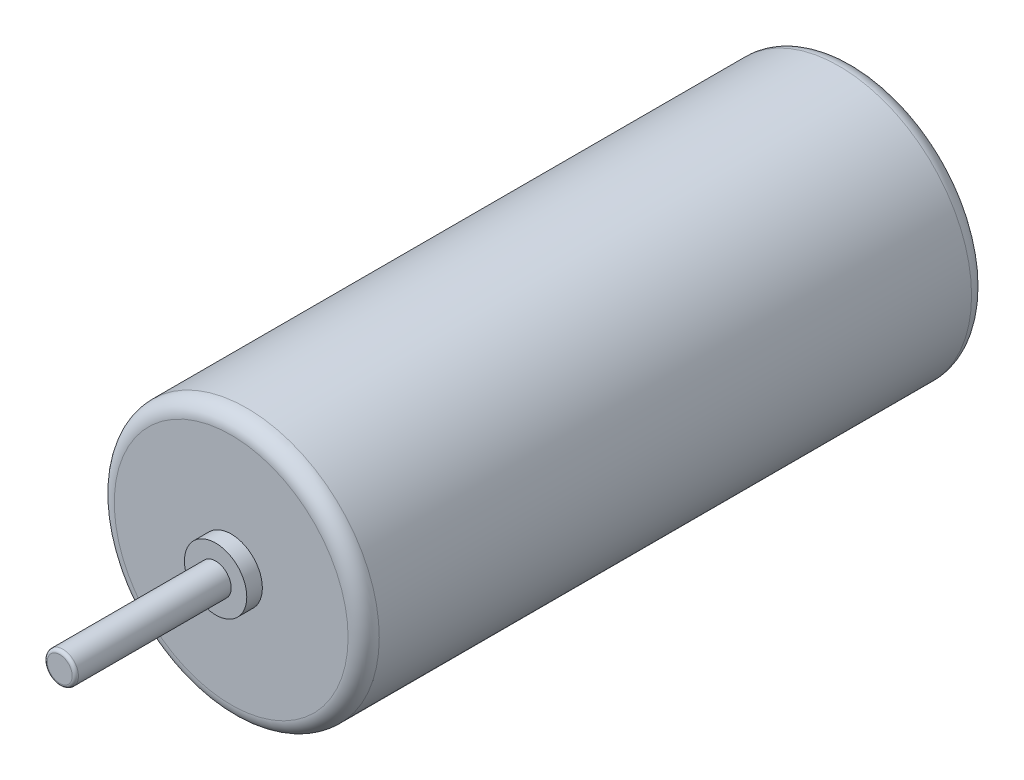
from build123d import *

# Parameters (mm, degrees)
SKETCH1_R           = 4.25
BOSS_EXTRUDE1_DEPTH = 20
SKETCH2_R           = 1
BOSS_EXTRUDE2_DEPTH = 0.5
SKETCH3_R           = 0.5
BOSS_EXTRUDE3_DEPTH = 5
FILLET2_R           = 0.5
FILLET3_R           = 0.1
FILLET4_R           = 0.5


with BuildPart() as part:
    # Sketch1 → Boss-Extrude1 (new body)
    with BuildSketch(Plane.XY):
        Circle(SKETCH1_R)
    extrude(amount=BOSS_EXTRUDE1_DEPTH)

    # Sketch2 → Boss-Extrude2 (add)
    with BuildSketch(Plane.XY.offset(20)):
        Circle(SKETCH2_R)
    extrude(amount=BOSS_EXTRUDE2_DEPTH)

    # Sketch3 → Boss-Extrude3 (add)
    with BuildSketch(Plane.XY.offset(20.5)):
        Circle(SKETCH3_R)
    extrude(amount=BOSS_EXTRUDE3_DEPTH)

    # Fillet2
    fillet2_edges = [part.edges().sort_by_distance(p)[0] for p in [
        (-4.25, 0, 20),
    ]]
    fillet(fillet2_edges, radius=FILLET2_R)

    # Fillet3
    fillet3_edges = [part.edges().sort_by_distance(p)[0] for p in [
        (-0.5, 0, 25.5),
    ]]
    fillet(fillet3_edges, radius=FILLET3_R)

    # Fillet4
    fillet4_edges = [part.edges().sort_by_distance(p)[0] for p in [
        (-4.25, 0, 0),
    ]]
    fillet(fillet4_edges, radius=FILLET4_R)


solid = part.part
